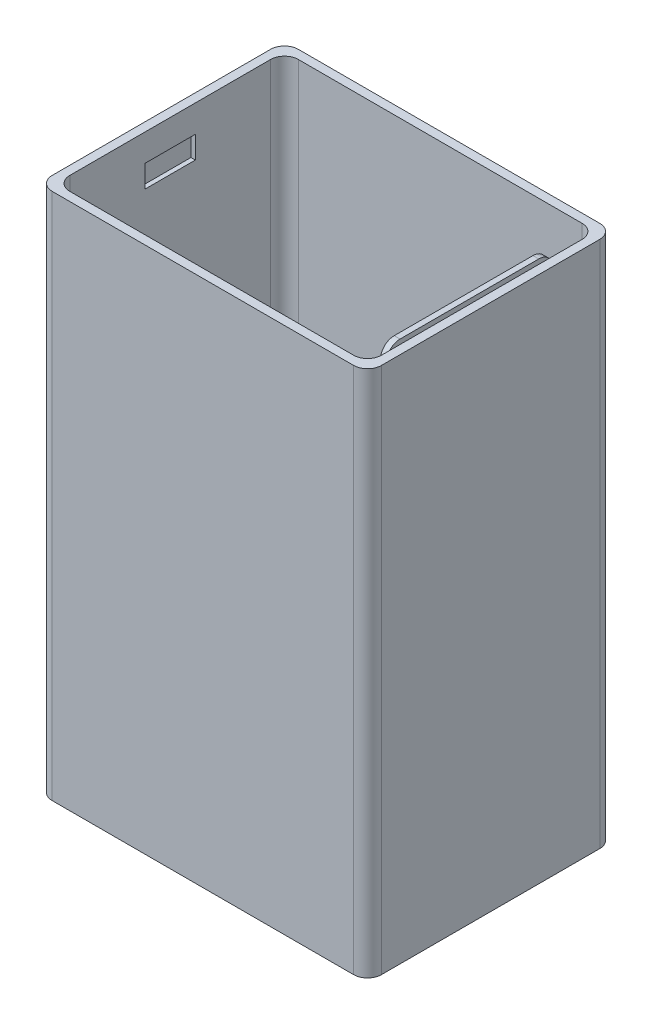
from build123d import *

# Parameters (mm, degrees)
SKETCH1_W           = 237.6932
SKETCH1_H           = 177.6984
SKETCH1_W_2         = 224.9932
SKETCH1_H_2         = 164.9984
BOSS_EXTRUDE1_DEPTH = 374.65
SKETCH4_W           = 107.442
SKETCH4_H           = 374.65
BOSS_EXTRUDE2_DEPTH = 9.017
SKETCH5_W           = 120.142
SKETCH5_H           = 374.65
BOSS_EXTRUDE3_DEPTH = 4.191
SKETCH7_W           = 9.017
SKETCH7_H           = 107.442
CUT_EXTRUDE1_DEPTH  = 21.59
SKETCH10_W          = 4.191
SKETCH10_H          = 120.142
CUT_EXTRUDE2_DEPTH  = 5.588
FILLET1_R           = 10
FILLET2_R           = 10
FILLET3_R           = 10
FILLET4_R           = 10
FILLET5_R           = 10
FILLET6_R           = 10
FILLET7_R           = 10
SKETCH11_W          = 50.8
SKETCH11_H          = 15.24
BOSS_EXTRUDE4_DEPTH = 19.9898
FILLET10_R          = 10
FILLET11_R          = 10
BOSS_EXTRUDE5_DEPTH = 6.35
FILLET13_R          = 10
SKETCH13_W          = 36.3982
SKETCH13_H          = 16.129
CUT_EXTRUDE4_DEPTH  = 3.175


with BuildPart() as part:
    # Sketch1 → Boss-Extrude1 (new body)
    with BuildSketch(Plane(origin=(0, 0, 0), x_dir=(1, 0, 0), z_dir=(0, 1, 0))):
        with Locations((112.4966, -82.4992)):
            Rectangle(SKETCH1_W, SKETCH1_H)
        with Locations((112.4966, -82.4992)):
            Rectangle(SKETCH1_W_2, SKETCH1_H_2, mode=Mode.SUBTRACT)
    extrude(amount=BOSS_EXTRUDE1_DEPTH)

    # Sketch4 → Boss-Extrude2 (add)
    with BuildSketch(Plane.ZY.offset(-224.9932)):
        with Locations((82.4484, 187.325)):
            Rectangle(SKETCH4_W, SKETCH4_H)
    extrude(amount=BOSS_EXTRUDE2_DEPTH)

    # Sketch5 → Boss-Extrude3 (add)
    with BuildSketch(Plane.ZY.offset(-215.9762)):
        with Locations((82.4484, 187.325)):
            Rectangle(SKETCH5_W, SKETCH5_H)
    extrude(amount=BOSS_EXTRUDE3_DEPTH)

    # Sketch7 → Cut-Extrude1 (cut)
    with BuildSketch(Plane(origin=(0, 374.65, 0), x_dir=(1, 0, 0), z_dir=(0, 1, 0))):
        with Locations((220.4847, -82.4484)):
            Rectangle(SKETCH7_W, SKETCH7_H)
    extrude(amount=-CUT_EXTRUDE1_DEPTH, mode=Mode.SUBTRACT)

    # Sketch10 → Cut-Extrude2 (cut)
    with BuildSketch(Plane(origin=(0, 374.65, 0), x_dir=(1, 0, 0), z_dir=(0, 1, 0))):
        with Locations((213.8807, -82.4484)):
            Rectangle(SKETCH10_W, SKETCH10_H)
    extrude(amount=-CUT_EXTRUDE2_DEPTH, mode=Mode.SUBTRACT)

    # Fillet1
    fillet1_edges = [part.edges().sort_by_distance(p)[0] for p in [
        (231.3432, 187.325, 171.3484),
    ]]
    fillet(fillet1_edges, radius=FILLET1_R)

    # Fillet2
    fillet2_edges = [part.edges().sort_by_distance(p)[0] for p in [
        (224.9932, 187.325, 164.9984),
    ]]
    fillet(fillet2_edges, radius=FILLET2_R)

    # Fillet3
    fillet3_edges = [part.edges().sort_by_distance(p)[0] for p in [
        (224.9932, 187.325, 0),
        (231.3432, 187.325, -6.35),
    ]]
    fillet(fillet3_edges, radius=FILLET3_R)

    # Fillet4
    fillet4_edges = [part.edges().sort_by_distance(p)[0] for p in [
        (0, 187.325, 164.9984),
        (-6.35, 187.325, 171.3484),
    ]]
    fillet(fillet4_edges, radius=FILLET4_R)

    # Fillet5
    fillet5_edges = [part.edges().sort_by_distance(p)[0] for p in [
        (0, 187.325, 0),
        (-6.35, 187.325, -6.35),
    ]]
    fillet(fillet5_edges, radius=FILLET5_R)

    # Fillet6
    fillet6_edges = [part.edges().sort_by_distance(p)[0] for p in [
        (220.4847, 353.06, 28.7274),
        (220.4847, 353.06, 136.1694),
    ]]
    fillet(fillet6_edges, radius=FILLET6_R)

    # Fillet7
    fillet7_edges = [part.edges().sort_by_distance(p)[0] for p in [
        (213.8807, 369.062, 22.3774),
        (213.8807, 369.062, 142.5194),
    ]]
    fillet(fillet7_edges, radius=FILLET7_R)

    # Sketch11 → Boss-Extrude4 (add)
    with BuildSketch(Plane.ZY.offset(-211.7852)):
        with Locations((82.4484, 7.62)):
            Rectangle(SKETCH11_W, SKETCH11_H)
    extrude(amount=BOSS_EXTRUDE4_DEPTH)

    # Fillet10
    fillet10_edges = [part.edges().sort_by_distance(p)[0] for p in [
        (191.7954, 7.62, 57.0484),
        (191.7954, 7.62, 107.8484),
    ]]
    fillet(fillet10_edges, radius=FILLET10_R)

    # Fillet11
    fillet11_edges = [part.edges().sort_by_distance(p)[0] for p in [
        (191.7954, 15.24, 82.4484),
        (206.7903, 15.24, 57.0484),
        (206.7903, 15.24, 107.8484),
        (194.724332188, 15.24, 59.977332188),
        (194.724332188, 15.24, 104.919467812),
    ]]
    fillet(fillet11_edges, radius=FILLET11_R)

    # Sketch12 → Boss-Extrude5 (add)
    with BuildSketch(Plane.XZ):
        with BuildLine():
            Line((231.3432, 161.3484), (231.3432, 3.65))
            ThreePointArc((231.3432, 3.65), (228.414267812, -3.421067812), (221.3432, -6.35))
            Line((221.3432, -6.35), (3.65, -6.35))
            ThreePointArc((3.65, -6.35), (-3.421067812, -3.421067812), (-6.35, 3.65))
            Line((-6.35, 3.65), (-6.35, 161.3484))
            ThreePointArc((-6.35, 161.3484), (-3.421067812, 168.419467812), (3.65, 171.3484))
            Line((3.65, 171.3484), (221.3432, 171.3484))
            ThreePointArc((221.3432, 171.3484), (228.414267812, 168.419467812), (231.3432, 161.3484))
        make_face()
    extrude(amount=BOSS_EXTRUDE5_DEPTH)

    # Fillet13
    fillet13_edges = [part.edges().sort_by_distance(p)[0] for p in [
        (224.9932, 0, 19.3637),
        (222.064267812, 0, 2.928932188),
        (112.4966, 0, 0),
        (2.928932188, 0, 2.928932188),
        (224.9932, 0, 145.5839),
        (222.064267812, 0, 162.069467812),
        (112.4966, 0, 164.9984),
        (2.928932188, 0, 162.069467812),
        (0, 0, 82.4992),
    ]]
    fillet(fillet13_edges, radius=FILLET13_R)

    # Sketch13 → Cut-Extrude4 (cut)
    with BuildSketch(Plane(origin=(0, 0, 0), x_dir=(0, 0, -1), z_dir=(1, 0, 0))):
        with Locations((-82.5551, 346.9767)):
            Rectangle(SKETCH13_W, SKETCH13_H)
    extrude(amount=-CUT_EXTRUDE4_DEPTH, mode=Mode.SUBTRACT)


solid = part.part
